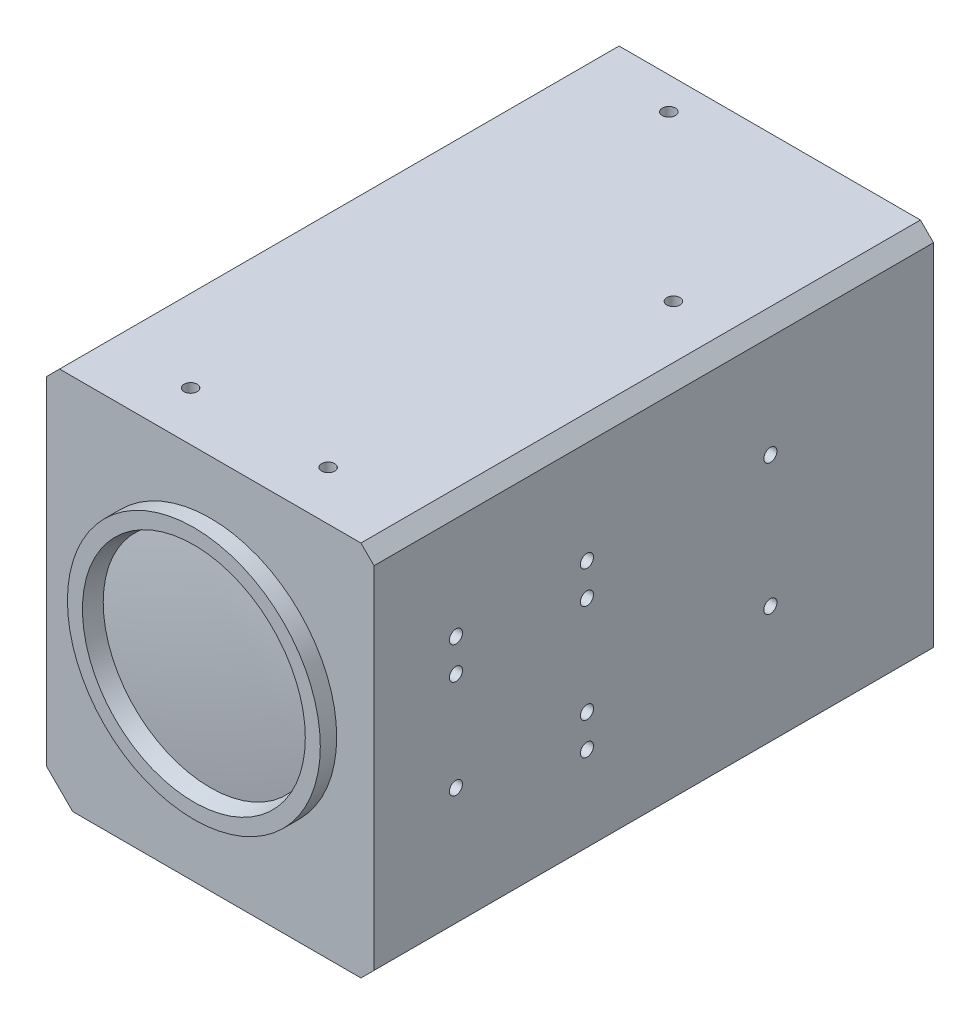
from build123d import *

# Parameters (mm, degrees)
BOSS_EXTRUDE1_DEPTH                    = 85.399999968
SKETCH2_R                              = 19.3
SKETCH2_R_2                            = 17.008
BOSS_EXTRUDE2_DEPTH                    = 2.5
DRAFT1_ANGLE                           = 15
DOME1_FACE_RADIUS                      = 16.338127019
DOME1_HEIGHT                           = 1
F_2_0_2_DIAMETER_HOLE1_D               = 2
F_2_0_2_DIAMETER_HOLE1_DEPTH           = 4
F_2_0_2_DIAMETER_HOLE1_TIP             = 0.600860619
F_2_0_2_DIAMETER_HOLE1_ON_FACE_2_D     = 2
F_2_0_2_DIAMETER_HOLE1_ON_FACE_2_DEPTH = 4
F_2_0_2_DIAMETER_HOLE1_ON_FACE_2_TIP   = 0.600860619
F_2_0_2_DIAMETER_HOLE1_ON_FACE_3_D     = 2
F_2_0_2_DIAMETER_HOLE1_ON_FACE_3_DEPTH = 4
F_2_0_2_DIAMETER_HOLE1_ON_FACE_3_TIP   = 0.600860619
F_2_0_2_DIAMETER_HOLE1_ON_FACE_4_D     = 2
F_2_0_2_DIAMETER_HOLE1_ON_FACE_4_DEPTH = 4
F_2_0_2_DIAMETER_HOLE1_ON_FACE_4_TIP   = 0.600860619
F_1_4_CLEARANCE_HOLE1_D                = 6.7564
F_1_4_CLEARANCE_HOLE1_DEPTH            = 8
F_1_4_CLEARANCE_HOLE1_TIP              = 2.029827343


with BuildPart() as part:
    # Sketch1 → Boss-Extrude1 (new body)
    with BuildSketch(Plane.XY):
        Polygon((-25, 25.5), (-23, 27.5), (23, 27.5), (25, 25.5), (25, -28), (23, -30), (-21, -30), (-25, -26), align=None)
    extrude(amount=BOSS_EXTRUDE1_DEPTH)

    # Sketch2 → Boss-Extrude2 (add)
    with BuildSketch(Plane.XY.offset(85.399999968)):
        with Locations(Location((0, 0, 0), (0, 0, 180))):
            Circle(SKETCH2_R)
        Circle(SKETCH2_R_2, mode=Mode.SUBTRACT)
    extrude(amount=BOSS_EXTRUDE2_DEPTH)

    # Draft1
    draft1_faces = [part.faces().sort_by_distance(p)[0] for p in [
        (-17.008, 0, 86.649999968),
    ]]
    draft(draft1_faces, Plane.XY.offset(87.899999968), DRAFT1_ANGLE)

    # Dome1: a dome of height H over a round flat face of radius A is a cap of a sphere of radius (A * A + H * H) / (2 * H)
    dome1_r = (DOME1_FACE_RADIUS * DOME1_FACE_RADIUS + DOME1_HEIGHT * DOME1_HEIGHT) / (2 * DOME1_HEIGHT)
    dome1_base = Plane((0, 0, 85.399999968), z_dir=(0, 0, 1))
    with Locations(dome1_base.offset(DOME1_HEIGHT - dome1_r)):
        dome1_ball = Sphere(dome1_r, mode=Mode.PRIVATE)
    add(split(dome1_ball, bisect_by=dome1_base, keep=Keep.TOP, mode=Mode.PRIVATE))

    # Ø2.0 (2) Diameter Hole1
    with Locations(Plane(origin=(25, 9.899748742, 72.899999968), x_dir=(0, 0, 1), z_dir=(1, 0, 0))):
        with Locations((0, 0), (-20, 0), (0, 4.956938323), (0, 20), (-20, 4.956938323), (-20, 20), (-20, 24.956938323), (-48, 0), (-48, 20)):
            Hole(F_2_0_2_DIAMETER_HOLE1_D / 2, depth=F_2_0_2_DIAMETER_HOLE1_DEPTH)
            with Locations((0, 0, -(F_2_0_2_DIAMETER_HOLE1_DEPTH + F_2_0_2_DIAMETER_HOLE1_TIP / 2))):  # 118° drill point
                Cone(0, F_2_0_2_DIAMETER_HOLE1_D / 2, F_2_0_2_DIAMETER_HOLE1_TIP, mode=Mode.SUBTRACT)

    # Ø2.0 (2) Diameter Hole1 on face 2
    with Locations(Plane(origin=(-25, -9.732668619, 2.699999968), x_dir=(0, 0, -1), z_dir=(-1, 0, 0))):
        with Locations((0, 0), (0, -14)):
            Hole(F_2_0_2_DIAMETER_HOLE1_ON_FACE_2_D / 2, depth=F_2_0_2_DIAMETER_HOLE1_ON_FACE_2_DEPTH)
            with Locations((0, 0, -(F_2_0_2_DIAMETER_HOLE1_ON_FACE_2_DEPTH + F_2_0_2_DIAMETER_HOLE1_ON_FACE_2_TIP / 2))):  # 118° drill point
                Cone(0, F_2_0_2_DIAMETER_HOLE1_ON_FACE_2_D / 2, F_2_0_2_DIAMETER_HOLE1_ON_FACE_2_TIP, mode=Mode.SUBTRACT)

    # Ø2.0 (2) Diameter Hole1 on face 3
    with Locations(Plane(origin=(-10.5, 27.5, 77.899999968), x_dir=(0, 0, 1), z_dir=(0, 1, 0))):
        with Locations((0, 0), (0, 21), (-48.3, 25.4), (-73, 0)):
            Hole(F_2_0_2_DIAMETER_HOLE1_ON_FACE_3_D / 2, depth=F_2_0_2_DIAMETER_HOLE1_ON_FACE_3_DEPTH)
            with Locations((0, 0, -(F_2_0_2_DIAMETER_HOLE1_ON_FACE_3_DEPTH + F_2_0_2_DIAMETER_HOLE1_ON_FACE_3_TIP / 2))):  # 118° drill point
                Cone(0, F_2_0_2_DIAMETER_HOLE1_ON_FACE_3_D / 2, F_2_0_2_DIAMETER_HOLE1_ON_FACE_3_TIP, mode=Mode.SUBTRACT)

    # Ø2.0 (2) Diameter Hole1 on face 4
    with Locations(Plane(origin=(8, -30, 22.899999968), x_dir=(0, 0, -1), z_dir=(0, -1, 0))):
        with Locations((0, 0), (0, -16), (-29, -16), (-29, 0), (-24.8, 5.5), (-24.8, -21.5), (8.2, 5.5), (8.2, -21.5)):
            Hole(F_2_0_2_DIAMETER_HOLE1_ON_FACE_4_D / 2, depth=F_2_0_2_DIAMETER_HOLE1_ON_FACE_4_DEPTH)
            with Locations((0, 0, -(F_2_0_2_DIAMETER_HOLE1_ON_FACE_4_DEPTH + F_2_0_2_DIAMETER_HOLE1_ON_FACE_4_TIP / 2))):  # 118° drill point
                Cone(0, F_2_0_2_DIAMETER_HOLE1_ON_FACE_4_D / 2, F_2_0_2_DIAMETER_HOLE1_ON_FACE_4_TIP, mode=Mode.SUBTRACT)

    # 1/4 Clearance Hole1
    with Locations(Plane.XZ.offset(30)):
        with Locations((0, 67.899999968)):
            Hole(F_1_4_CLEARANCE_HOLE1_D / 2, depth=F_1_4_CLEARANCE_HOLE1_DEPTH)
            with Locations((0, 0, -(F_1_4_CLEARANCE_HOLE1_DEPTH + F_1_4_CLEARANCE_HOLE1_TIP / 2))):  # 118° drill point
                Cone(0, F_1_4_CLEARANCE_HOLE1_D / 2, F_1_4_CLEARANCE_HOLE1_TIP, mode=Mode.SUBTRACT)


solid = part.part
